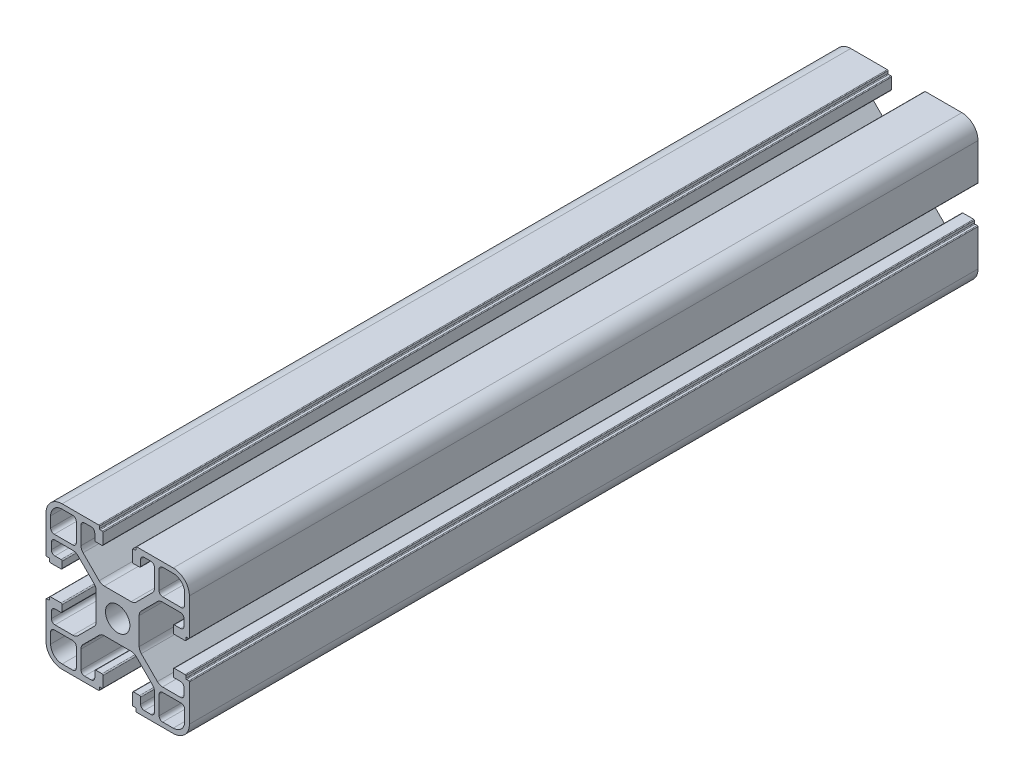
from build123d import *

# Parameters (mm, degrees)
SKETCH2_R                       = 3.4
BOSS_EXTRUDE1_DEPTH             = 220
WYTNIJ_WYCI_GNI_CIE1_DEPTH      = 228.156333832
WYTNIJ_WYCI_GNI_CIE1_DEPTH_BACK = 228.156333832
SZKIC1_R                        = 4


with BuildPart() as part:
    # Sketch2 → Boss-Extrude1 (new body)
    with BuildSketch(Plane.XY):
        with BuildLine():
            Line((4.5, 0), (14.7, 0))
            ThreePointArc((14.7, 0), (14.841421356, 0.058578644), (14.9, 0.2))
            Line((14.9, 0.2), (14.9, 0.8))
            ThreePointArc((14.9, 0.8), (14.958578644, 0.941421356), (15.1, 1))
            Line((15.1, 1), (15.7, 1))
            ThreePointArc((15.7, 1), (15.841421356, 1.058578644), (15.9, 1.2))
            Line((15.9, 1.2), (15.9, 4.2))
            ThreePointArc((15.9, 4.2), (15.812132034, 4.412132034), (15.6, 4.5))
            Line((15.6, 4.5), (13.9, 4.5))
            ThreePointArc((13.9, 4.5), (13.687867966, 4.412132034), (13.6, 4.2))
            Line((13.6, 4.2), (13.6, 2.5))
            ThreePointArc((13.6, 2.5), (13.307106781, 1.792893219), (12.6, 1.5))
            Line((12.6, 1.5), (10.75, 1.5))
            ThreePointArc((10.75, 1.5), (10.042893219, 1.792893219), (9.75, 2.5))
            Line((9.75, 2.5), (9.75, 7.507359313))
            ThreePointArc((9.75, 7.507359313), (9.902240935, 8.272726178), (10.335786438, 8.921572875))
            Line((10.335786438, 8.921572875), (14.828427125, 13.414213562))
            ThreePointArc((14.828427125, 13.414213562), (15.477273822, 13.847759065), (16.242640687, 14))
            Line((16.242640687, 14), (23.757359313, 14))
            ThreePointArc((23.757359313, 14), (24.522726178, 13.847759065), (25.171572875, 13.414213562))
            Line((25.171572875, 13.414213562), (29.664213562, 8.921572875))
            ThreePointArc((29.664213562, 8.921572875), (30.097759065, 8.272726178), (30.25, 7.507359313))
            Line((30.25, 7.507359313), (30.25, 2.5))
            ThreePointArc((30.25, 2.5), (29.957106781, 1.792893219), (29.25, 1.5))
            Line((29.25, 1.5), (27.4, 1.5))
            ThreePointArc((27.4, 1.5), (26.692893219, 1.792893219), (26.4, 2.5))
            Line((26.4, 2.5), (26.4, 4.2))
            ThreePointArc((26.4, 4.2), (26.312132034, 4.412132034), (26.1, 4.5))
            Line((26.1, 4.5), (24.4, 4.5))
            ThreePointArc((24.4, 4.5), (24.187867966, 4.412132034), (24.1, 4.2))
            Line((24.1, 4.2), (24.1, 1.2))
            ThreePointArc((24.1, 1.2), (24.158578644, 1.058578644), (24.3, 1))
            Line((24.3, 1), (24.9, 1))
            ThreePointArc((24.9, 1), (25.041421356, 0.941421356), (25.1, 0.8))
            Line((25.1, 0.8), (25.1, 0.2))
            ThreePointArc((25.1, 0.2), (25.158578644, 0.058578644), (25.3, 0))
            Line((25.3, 0), (35.5, 0))
            ThreePointArc((35.5, 0), (38.681980515, 1.318019485), (40, 4.5))
            Line((40, 4.5), (40, 14.7))
            ThreePointArc((40, 14.7), (39.941421356, 14.841421356), (39.8, 14.9))
            Line((39.8, 14.9), (39.2, 14.9))
            ThreePointArc((39.2, 14.9), (39.058578644, 14.958578644), (39, 15.1))
            Line((39, 15.1), (39, 15.7))
            ThreePointArc((39, 15.7), (38.941421356, 15.841421356), (38.8, 15.9))
            Line((38.8, 15.9), (35.8, 15.9))
            ThreePointArc((35.8, 15.9), (35.587867966, 15.812132034), (35.5, 15.6))
            Line((35.5, 15.6), (35.5, 13.9))
            ThreePointArc((35.5, 13.9), (35.587867966, 13.687867966), (35.8, 13.6))
            Line((35.8, 13.6), (37.5, 13.6))
            ThreePointArc((37.5, 13.6), (38.207106781, 13.307106781), (38.5, 12.6))
            Line((38.5, 12.6), (38.5, 10.75))
            ThreePointArc((38.5, 10.75), (38.207106781, 10.042893219), (37.5, 9.75))
            Line((37.5, 9.75), (32.492640687, 9.75))
            ThreePointArc((32.492640687, 9.75), (31.727273822, 9.902240935), (31.078427125, 10.335786438))
            Line((31.078427125, 10.335786438), (26.585786438, 14.828427125))
            ThreePointArc((26.585786438, 14.828427125), (26.152240935, 15.477273822), (26, 16.242640687))
            Line((26, 16.242640687), (26, 23.757359313))
            ThreePointArc((26, 23.757359313), (26.152240935, 24.522726178), (26.585786438, 25.171572875))
            Line((26.585786438, 25.171572875), (31.078427125, 29.664213562))
            ThreePointArc((31.078427125, 29.664213562), (31.727273822, 30.097759065), (32.492640687, 30.25))
            Line((32.492640687, 30.25), (37.5, 30.25))
            ThreePointArc((37.5, 30.25), (38.207106781, 29.957106781), (38.5, 29.25))
            Line((38.5, 29.25), (38.5, 27.4))
            ThreePointArc((38.5, 27.4), (38.207106781, 26.692893219), (37.5, 26.4))
            Line((37.5, 26.4), (35.8, 26.4))
            ThreePointArc((35.8, 26.4), (35.587867966, 26.312132034), (35.5, 26.1))
            Line((35.5, 26.1), (35.5, 24.4))
            ThreePointArc((35.5, 24.4), (35.587867966, 24.187867966), (35.8, 24.1))
            Line((35.8, 24.1), (38.8, 24.1))
            ThreePointArc((38.8, 24.1), (38.941421356, 24.158578644), (39, 24.3))
            Line((39, 24.3), (39, 24.9))
            ThreePointArc((39, 24.9), (39.058578644, 25.041421356), (39.2, 25.1))
            Line((39.2, 25.1), (39.8, 25.1))
            ThreePointArc((39.8, 25.1), (39.941421356, 25.158578644), (40, 25.3))
            Line((40, 25.3), (40, 35.5))
            ThreePointArc((40, 35.5), (38.681980515, 38.681980515), (35.5, 40))
            Line((35.5, 40), (25.3, 40))
            ThreePointArc((25.3, 40), (25.158578644, 39.941421356), (25.1, 39.8))
            Line((25.1, 39.8), (25.1, 39.2))
            ThreePointArc((25.1, 39.2), (25.041421356, 39.058578644), (24.9, 39))
            Line((24.9, 39), (24.3, 39))
            ThreePointArc((24.3, 39), (24.158578644, 38.941421356), (24.1, 38.8))
            Line((24.1, 38.8), (24.1, 35.8))
            ThreePointArc((24.1, 35.8), (24.187867966, 35.587867966), (24.4, 35.5))
            Line((24.4, 35.5), (26.1, 35.5))
            ThreePointArc((26.1, 35.5), (26.312132034, 35.587867966), (26.4, 35.8))
            Line((26.4, 35.8), (26.4, 37.5))
            ThreePointArc((26.4, 37.5), (26.692893219, 38.207106781), (27.4, 38.5))
            Line((27.4, 38.5), (29.25, 38.5))
            ThreePointArc((29.25, 38.5), (29.957106781, 38.207106781), (30.25, 37.5))
            Line((30.25, 37.5), (30.25, 32.492640687))
            ThreePointArc((30.25, 32.492640687), (30.097759065, 31.727273822), (29.664213562, 31.078427125))
            Line((29.664213562, 31.078427125), (25.171572875, 26.585786438))
            ThreePointArc((25.171572875, 26.585786438), (24.522726178, 26.152240935), (23.757359313, 26))
            Line((23.757359313, 26), (16.242640687, 26))
            ThreePointArc((16.242640687, 26), (15.477273822, 26.152240935), (14.828427125, 26.585786438))
            Line((14.828427125, 26.585786438), (10.335786438, 31.078427125))
            ThreePointArc((10.335786438, 31.078427125), (9.902240935, 31.727273822), (9.75, 32.492640687))
            Line((9.75, 32.492640687), (9.75, 37.5))
            ThreePointArc((9.75, 37.5), (10.042893219, 38.207106781), (10.75, 38.5))
            Line((10.75, 38.5), (12.6, 38.5))
            ThreePointArc((12.6, 38.5), (13.307106781, 38.207106781), (13.6, 37.5))
            Line((13.6, 37.5), (13.6, 35.8))
            ThreePointArc((13.6, 35.8), (13.687867966, 35.587867966), (13.9, 35.5))
            Line((13.9, 35.5), (15.6, 35.5))
            ThreePointArc((15.6, 35.5), (15.812132034, 35.587867966), (15.9, 35.8))
            Line((15.9, 35.8), (15.9, 38.8))
            ThreePointArc((15.9, 38.8), (15.841421356, 38.941421356), (15.7, 39))
            Line((15.7, 39), (15.1, 39))
            ThreePointArc((15.1, 39), (14.958578644, 39.058578644), (14.9, 39.2))
            Line((14.9, 39.2), (14.9, 39.8))
            ThreePointArc((14.9, 39.8), (14.841421356, 39.941421356), (14.7, 40))
            Line((14.7, 40), (4.5, 40))
            ThreePointArc((4.5, 40), (1.318019485, 38.681980515), (0, 35.5))
            Line((0, 35.5), (0, 25.3))
            ThreePointArc((0, 25.3), (0.058578644, 25.158578644), (0.2, 25.1))
            Line((0.2, 25.1), (0.8, 25.1))
            ThreePointArc((0.8, 25.1), (0.941421356, 25.041421356), (1, 24.9))
            Line((1, 24.9), (1, 24.3))
            ThreePointArc((1, 24.3), (1.058578644, 24.158578644), (1.2, 24.1))
            Line((1.2, 24.1), (4.2, 24.1))
            ThreePointArc((4.2, 24.1), (4.412132034, 24.187867966), (4.5, 24.4))
            Line((4.5, 24.4), (4.5, 26.1))
            ThreePointArc((4.5, 26.1), (4.412132034, 26.312132034), (4.2, 26.4))
            Line((4.2, 26.4), (2.5, 26.4))
            ThreePointArc((2.5, 26.4), (1.792893219, 26.692893219), (1.5, 27.4))
            Line((1.5, 27.4), (1.5, 29.25))
            ThreePointArc((1.5, 29.25), (1.792893219, 29.957106781), (2.5, 30.25))
            Line((2.5, 30.25), (7.507359313, 30.25))
            ThreePointArc((7.507359313, 30.25), (8.272726178, 30.097759065), (8.921572875, 29.664213562))
            Line((8.921572875, 29.664213562), (13.414213562, 25.171572875))
            ThreePointArc((13.414213562, 25.171572875), (13.847759065, 24.522726178), (14, 23.757359313))
            Line((14, 23.757359313), (14, 16.242640687))
            ThreePointArc((14, 16.242640687), (13.847759065, 15.477273822), (13.414213562, 14.828427125))
            Line((13.414213562, 14.828427125), (8.921572875, 10.335786438))
            ThreePointArc((8.921572875, 10.335786438), (8.272726178, 9.902240935), (7.507359313, 9.75))
            Line((7.507359313, 9.75), (2.5, 9.75))
            ThreePointArc((2.5, 9.75), (1.792893219, 10.042893219), (1.5, 10.75))
            Line((1.5, 10.75), (1.5, 12.6))
            ThreePointArc((1.5, 12.6), (1.792893219, 13.307106781), (2.5, 13.6))
            Line((2.5, 13.6), (4.2, 13.6))
            ThreePointArc((4.2, 13.6), (4.412132034, 13.687867966), (4.5, 13.9))
            Line((4.5, 13.9), (4.5, 15.6))
            ThreePointArc((4.5, 15.6), (4.412132034, 15.812132034), (4.2, 15.9))
            Line((4.2, 15.9), (1.2, 15.9))
            ThreePointArc((1.2, 15.9), (1.058578644, 15.841421356), (1, 15.7))
            Line((1, 15.7), (1, 15.1))
            ThreePointArc((1, 15.1), (0.941421356, 14.958578644), (0.8, 14.9))
            Line((0.8, 14.9), (0.2, 14.9))
            ThreePointArc((0.2, 14.9), (0.058578644, 14.841421356), (0, 14.7))
            Line((0, 14.7), (0, 4.5))
            ThreePointArc((0, 4.5), (1.318019485, 1.318019485), (4.5, 0))
        make_face()
        with Locations((20, 20)):
            Circle(SKETCH2_R, mode=Mode.SUBTRACT)
        with BuildLine():
            Line((31.55, 37.7), (31.55, 32.55))
            ThreePointArc((31.55, 32.55), (31.842893219, 31.842893219), (32.55, 31.55))
            Line((32.55, 31.55), (37.7, 31.55))
            ThreePointArc((37.7, 31.55), (38.407106781, 31.842893219), (38.7, 32.55))
            Line((38.7, 32.55), (38.7, 35.5))
            ThreePointArc((38.7, 35.5), (37.7627417, 37.7627417), (35.5, 38.7))
            Line((35.5, 38.7), (32.55, 38.7))
            ThreePointArc((32.55, 38.7), (31.842893219, 38.407106781), (31.55, 37.7))
        make_face(mode=Mode.SUBTRACT)
        with BuildLine():
            Line((1.3, 35.5), (1.3, 32.55))
            ThreePointArc((1.3, 32.55), (1.592893219, 31.842893219), (2.3, 31.55))
            Line((2.3, 31.55), (7.45, 31.55))
            ThreePointArc((7.45, 31.55), (8.157106781, 31.842893219), (8.45, 32.55))
            Line((8.45, 32.55), (8.45, 37.7))
            ThreePointArc((8.45, 37.7), (8.157106781, 38.407106781), (7.45, 38.7))
            Line((7.45, 38.7), (4.5, 38.7))
            ThreePointArc((4.5, 38.7), (2.2372583, 37.7627417), (1.3, 35.5))
        make_face(mode=Mode.SUBTRACT)
        with BuildLine():
            Line((1.3, 7.45), (1.3, 4.5))
            ThreePointArc((1.3, 4.5), (2.2372583, 2.2372583), (4.5, 1.3))
            Line((4.5, 1.3), (7.45, 1.3))
            ThreePointArc((7.45, 1.3), (8.157106781, 1.592893219), (8.45, 2.3))
            Line((8.45, 2.3), (8.45, 7.45))
            ThreePointArc((8.45, 7.45), (8.157106781, 8.157106781), (7.45, 8.45))
            Line((7.45, 8.45), (2.3, 8.45))
            ThreePointArc((2.3, 8.45), (1.592893219, 8.157106781), (1.3, 7.45))
        make_face(mode=Mode.SUBTRACT)
        with BuildLine():
            Line((31.55, 7.45), (31.55, 2.3))
            ThreePointArc((31.55, 2.3), (31.842893219, 1.592893219), (32.55, 1.3))
            Line((32.55, 1.3), (35.5, 1.3))
            ThreePointArc((35.5, 1.3), (37.7627417, 2.2372583), (38.7, 4.5))
            Line((38.7, 4.5), (38.7, 7.45))
            ThreePointArc((38.7, 7.45), (38.407106781, 8.157106781), (37.7, 8.45))
            Line((37.7, 8.45), (32.55, 8.45))
            ThreePointArc((32.55, 8.45), (31.842893219, 8.157106781), (31.55, 7.45))
        make_face(mode=Mode.SUBTRACT)
    extrude(amount=BOSS_EXTRUDE1_DEPTH)

    # Szkic1 → Wytnij-wyciągnięcie1 (cut, two sides: drawn at the far end of the back side and taken through both)
    with BuildSketch(Plane(origin=(0, 40, 0), x_dir=(1, 0, 0), z_dir=(0, 1, 0)).offset(-WYTNIJ_WYCI_GNI_CIE1_DEPTH_BACK)):
        with Locations(Location((20, -110, 0), (0, 0, 339.940983105))):
            Circle(SZKIC1_R)
    extrude(amount=WYTNIJ_WYCI_GNI_CIE1_DEPTH + WYTNIJ_WYCI_GNI_CIE1_DEPTH_BACK, mode=Mode.SUBTRACT)


solid = part.part
